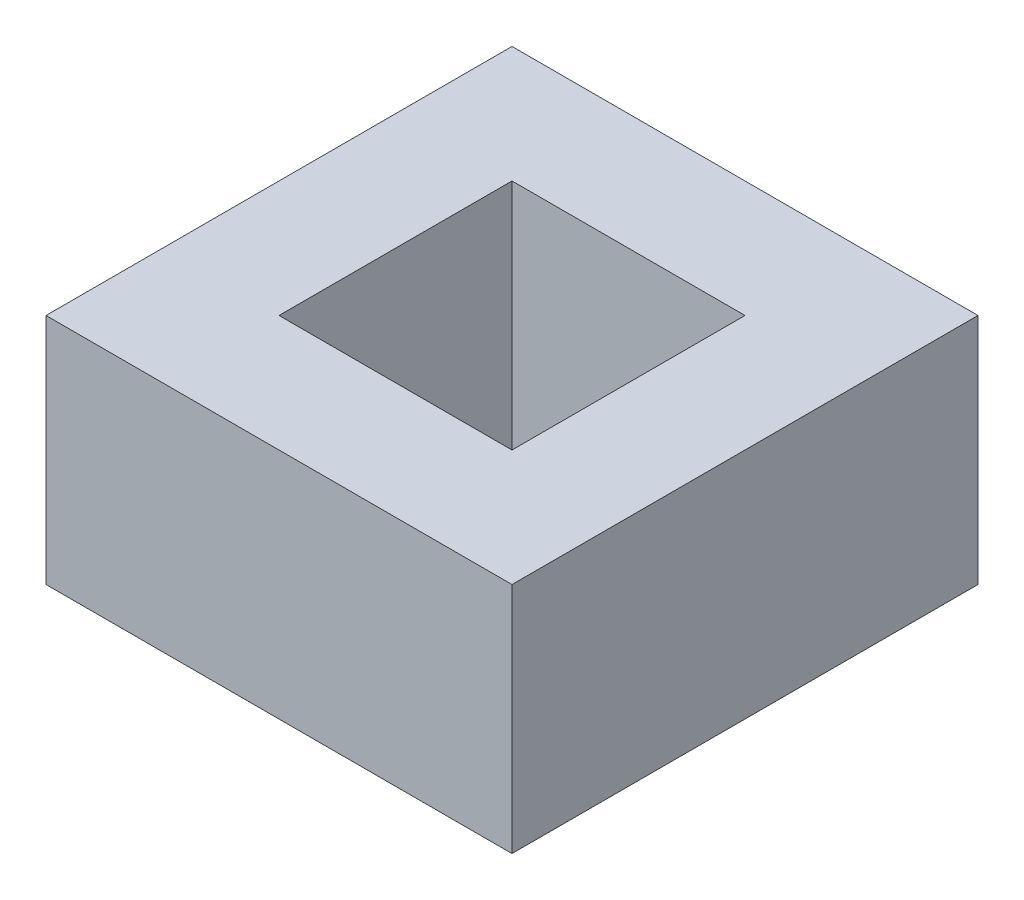
from build123d import *

# Parameters (mm, degrees)
SKETCH_1_W      = 20
SKETCH_1_H      = 20
SKETCH_1_W_2    = 10
SKETCH_1_H_2    = 10
EXTRUDE_1_DEPTH = 10


with BuildPart() as part:
    # 草图1 → 凸台-拉伸1 (new body)
    with BuildSketch(Plane(origin=(0, 0, 0), x_dir=(1, 0, 0), z_dir=(0, 1, 0))):
        with Locations((5, 5)):
            Rectangle(SKETCH_1_W, SKETCH_1_H)
        with Locations((5, 5)):
            Rectangle(SKETCH_1_W_2, SKETCH_1_H_2, mode=Mode.SUBTRACT)
    extrude(amount=EXTRUDE_1_DEPTH)


solid = part.part
